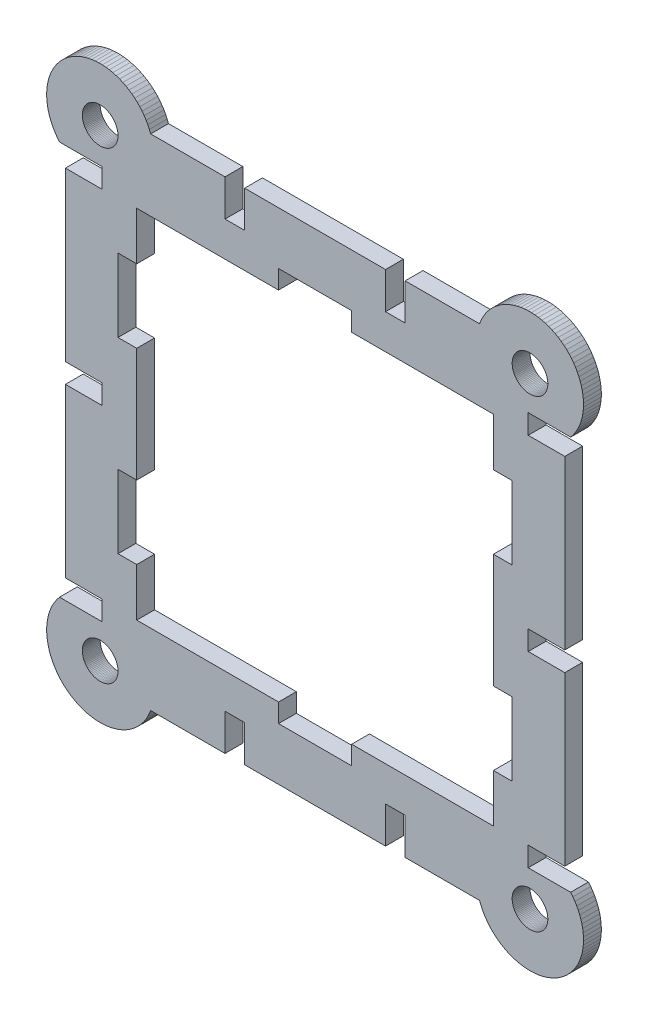
from build123d import *

# Parameters (mm, degrees)
BOSS_EXTRUDE1_DEPTH = 2.5


with BuildPart() as part:
    # Sketch1 → Boss-Extrude1 (new, symmetric)
    with BuildSketch(Plane.XY):
        Polygon((1128.295659386, -84.191167375), (1128.295659386, -73.941167375), (1107.438315784, -73.941167375), (1107.076497539, -73.016401308), (1106.654284467, -72.117601639), (1106.173526996, -71.248707529), (1105.636332136, -70.413527067), (1105.045054244, -69.615720588), (1104.402284707, -68.858784631), (1103.710840583, -68.146036607), (1102.973752255, -67.48060027), (1102.194250151, -66.865392019), (1101.375750586, -66.30310812), (1100.521840788, -65.796212886), (1099.636263175, -65.346927883), (1098.72289896, -64.957222185), (1097.78575113, -64.628803751), (1096.828926914, -64.363111936), (1095.856619772, -64.161311185), (1094.873091023, -64.024285927), (1093.882651166, -63.952636701), (1092.88964099, -63.946677523), (1091.898412548, -64.006434511), (1090.913310085, -64.131645769), (1089.938650997, -64.321762533), (1088.978706911, -64.575951583), (1088.037684961, -64.893098887), (1087.119709354, -65.271814487), (1086.228803288, -65.710438591), (1085.368871329, -66.207048847), (1084.543682287, -66.759468767), (1083.75685271, -67.365277266), (1083.011831026, -68.021819277), (1082.311882432, -68.726217379), (1081.660074583, -69.475384417), (1081.059264151, -70.266037025), (1080.5120843, -71.09471002), (1080.020933147, -71.957771586), (1079.587963256, -72.851439195), (1079.215072198, -73.77179618), (1078.903894238, -74.714808905), (1078.655793171, -75.676344438), (1078.471856348, -76.652188671), (1078.352889906, -77.638064783), (1078.299415237, -78.629651986), (1078.311666705, -79.622604464), (1078.389590615, -80.612570416), (1078.532845451, -81.59521113), (1078.740803371, -82.56622), (1079.012552962, -83.521341396), (1079.34690323, -84.45638932), (1079.742388821, -85.367265749), (1080.197276446, -86.249978596), (1080.709572474, -87.100659207), (1081.277031673, -87.915579313), (1081.897167045, -88.691167375), (1093.795659386, -88.691167375), (1093.795659386, -94.191167375), (1083.545659386, -94.191167375), (1083.545659386, -141.191167375), (1093.795659386, -141.191167375), (1093.795659386, -146.691167375), (1083.545659386, -146.691167375), (1083.545659386, -193.691167375), (1093.795659386, -193.691167375), (1093.795659386, -199.191167375), (1081.897167045, -199.191167375), (1081.277031673, -199.966755437), (1080.709572474, -200.781675543), (1080.197276446, -201.632356153), (1079.742388821, -202.515069), (1079.34690323, -203.425945429), (1079.012552962, -204.360993353), (1078.740803371, -205.31611475), (1078.532845451, -206.287123619), (1078.389590615, -207.269764334), (1078.311666705, -208.259730286), (1078.299415237, -209.252682764), (1078.352889906, -210.244269967), (1078.471856348, -211.230146078), (1078.655793171, -212.205990311), (1078.903894238, -213.167525845), (1079.215072198, -214.110538569), (1079.587963256, -215.030895555), (1080.020933147, -215.924563164), (1080.5120843, -216.78762473), (1081.059264151, -217.616297724), (1081.660074583, -218.406950332), (1082.311882432, -219.15611737), (1083.011831026, -219.860515473), (1083.75685271, -220.517057483), (1084.543682287, -221.122865983), (1085.368871329, -221.675285903), (1086.228803288, -222.171896159), (1087.119709354, -222.610520263), (1088.037684961, -222.989235863), (1088.978706911, -223.306383166), (1089.938650997, -223.560572216), (1090.913310085, -223.750688981), (1091.898412548, -223.875900238), (1092.88964099, -223.935657226), (1093.882651166, -223.929698049), (1094.873091023, -223.858048823), (1095.856619772, -223.721023565), (1096.828926914, -223.519222813), (1097.78575113, -223.253530999), (1098.72289896, -222.925112565), (1099.636263175, -222.535406867), (1100.521840788, -222.086121863), (1101.375750586, -221.57922663), (1102.194250151, -221.01694273), (1102.973752255, -220.401734479), (1103.710840583, -219.736298142), (1104.402284707, -219.023550119), (1105.045054244, -218.266614161), (1105.636332136, -217.468807683), (1106.173526996, -216.633627221), (1106.654284467, -215.76473311), (1107.076497539, -214.865933442), (1107.438315784, -213.941167375), (1128.295659386, -213.941167375), (1128.295659386, -203.691167375), (1133.795659386, -203.691167375), (1133.795659386, -213.941167375), (1173.295659386, -213.941167375), (1173.295659386, -203.691167375), (1178.795659386, -203.691167375), (1178.795659386, -213.941167375), (1199.653002988, -213.941167375), (1200.014821233, -214.865933442), (1200.437034305, -215.76473311), (1200.917791776, -216.633627221), (1201.454986636, -217.468807683), (1202.046264528, -218.266614161), (1202.689034065, -219.023550119), (1203.380478189, -219.736298142), (1204.117566517, -220.401734479), (1204.89706862, -221.01694273), (1205.715568186, -221.57922663), (1206.569477984, -222.086121863), (1207.455055596, -222.535406867), (1208.368419812, -222.925112565), (1209.305567641, -223.253530999), (1210.262391858, -223.519222813), (1211.234699, -223.721023565), (1212.218227749, -223.858048823), (1213.208667606, -223.929698049), (1214.201677782, -223.935657226), (1215.192906224, -223.875900238), (1216.178008687, -223.750688981), (1217.152667775, -223.560572216), (1218.112611861, -223.306383166), (1219.053633811, -222.989235863), (1219.971609418, -222.610520263), (1220.862515483, -222.171896159), (1221.722447443, -221.675285903), (1222.547636485, -221.122865983), (1223.334466061, -220.517057483), (1224.079487746, -219.860515473), (1224.77943634, -219.15611737), (1225.431244189, -218.406950332), (1226.032054621, -217.616297724), (1226.579234472, -216.78762473), (1227.070385625, -215.924563164), (1227.503355516, -215.030895555), (1227.876246574, -214.110538569), (1228.187424534, -213.167525845), (1228.435525601, -212.205990311), (1228.619462424, -211.230146078), (1228.738428866, -210.244269967), (1228.791903535, -209.252682764), (1228.779652067, -208.259730286), (1228.701728157, -207.269764334), (1228.558473321, -206.287123619), (1228.3505154, -205.31611475), (1228.07876581, -204.360993353), (1227.744415542, -203.425945429), (1227.348929951, -202.515069), (1226.894042326, -201.632356153), (1226.381746298, -200.781675543), (1225.814287099, -199.966755437), (1225.194151727, -199.191167375), (1213.295659386, -199.191167375), (1213.295659386, -193.691167375), (1223.545659386, -193.691167375), (1223.545659386, -146.691167375), (1213.295659386, -146.691167375), (1213.295659386, -141.191167375), (1223.545659386, -141.191167375), (1223.545659386, -94.191167375), (1213.295659386, -94.191167375), (1213.295659386, -88.691167375), (1225.194151727, -88.691167375), (1225.814287099, -87.915579313), (1226.381746298, -87.100659207), (1226.894042326, -86.249978596), (1227.348929951, -85.367265749), (1227.744415542, -84.45638932), (1228.07876581, -83.521341396), (1228.3505154, -82.56622), (1228.558473321, -81.59521113), (1228.701728157, -80.612570416), (1228.779652067, -79.622604464), (1228.791903535, -78.629651986), (1228.738428866, -77.638064783), (1228.619462424, -76.652188671), (1228.435525601, -75.676344438), (1228.187424534, -74.714808905), (1227.876246574, -73.77179618), (1227.503355516, -72.851439195), (1227.070385625, -71.957771586), (1226.579234472, -71.09471002), (1226.032054621, -70.266037025), (1225.431244189, -69.475384417), (1224.77943634, -68.726217379), (1224.079487746, -68.021819277), (1223.334466061, -67.365277266), (1222.547636485, -66.759468766), (1221.722447443, -66.207048847), (1220.862515483, -65.710438591), (1219.971609418, -65.271814487), (1219.053633811, -64.893098887), (1218.112611861, -64.575951583), (1217.152667775, -64.321762533), (1216.178008687, -64.131645769), (1215.192906224, -64.006434511), (1214.201677782, -63.946677523), (1213.208667606, -63.952636701), (1212.218227749, -64.024285927), (1211.234699, -64.161311185), (1210.262391858, -64.363111936), (1209.305567641, -64.628803751), (1208.368419812, -64.957222185), (1207.455055596, -65.346927883), (1206.569477984, -65.796212886), (1205.715568186, -66.30310812), (1204.89706862, -66.865392019), (1204.117566517, -67.48060027), (1203.380478189, -68.146036607), (1202.689034065, -68.858784631), (1202.046264528, -69.615720588), (1201.454986636, -70.413527067), (1200.917791776, -71.248707529), (1200.437034305, -72.117601639), (1200.014821233, -73.016401308), (1199.653002988, -73.941167375), (1178.795659386, -73.941167375), (1178.795659386, -84.191167375), (1173.295659386, -84.191167375), (1173.295659386, -73.941167375), (1133.795659386, -73.941167375), (1133.795659386, -84.191167375), align=None)
        Polygon((1143.295659386, -88.691167375), (1143.295659386, -93.941167375), (1103.545659386, -93.941167375), (1103.545659386, -107.441167375), (1098.295659386, -107.441167375), (1098.295659386, -127.941167375), (1103.545659386, -127.941167375), (1103.545659386, -159.94119829), (1098.295659386, -159.941167375), (1098.295659386, -180.441167375), (1103.545659386, -180.441167375), (1103.545659386, -193.941167375), (1143.295659386, -193.941167375), (1143.295659386, -199.191167375), (1163.795659386, -199.191167375), (1163.795659386, -193.941167375), (1203.545659386, -193.941167375), (1203.545659386, -180.441167375), (1208.795659386, -180.441167375), (1208.795659386, -159.941167375), (1203.545659386, -159.94119829), (1203.545659386, -127.941167375), (1208.795659386, -127.941167375), (1208.795659386, -107.441167375), (1203.545659386, -107.441167375), (1203.545659386, -93.941167375), (1163.795659386, -93.941167375), (1163.795659386, -88.691167375), align=None, mode=Mode.SUBTRACT)
        Polygon((1095.507623611, -204.456803667), (1095.79618016, -204.611040356), (1096.074031325, -204.783819313), (1096.339987305, -204.974400673), (1096.592909236, -205.181968337), (1096.831714066, -205.405633469), (1097.055379198, -205.644438299), (1097.262946862, -205.89736023), (1097.453528222, -206.16331621), (1097.626307179, -206.441167375), (1097.780543868, -206.729723924), (1097.915577823, -207.027750213), (1098.030830808, -207.333970048), (1098.125809292, -207.647072149), (1098.200106562, -207.965715765), (1098.253404467, -208.288536414), (1098.285474776, -208.614151729), (1098.29618016, -208.941167375), (1098.285474776, -209.268183021), (1098.253404467, -209.593798336), (1098.200106562, -209.916618985), (1098.125809292, -210.2352626), (1098.030830808, -210.548364701), (1097.915577823, -210.854584537), (1097.780543868, -211.152610826), (1097.626307179, -211.441167375), (1097.453528222, -211.71901854), (1097.262946862, -211.98497452), (1097.055379198, -212.23789645), (1096.831714066, -212.476701281), (1096.592909236, -212.700366412), (1096.339987305, -212.907934076), (1096.074031325, -213.098515436), (1095.79618016, -213.271294394), (1095.507623611, -213.425531082), (1095.209597322, -213.560565037), (1094.903377487, -213.675818022), (1094.590275386, -213.770796506), (1094.27163177, -213.845093777), (1093.948811121, -213.898391682), (1093.623195806, -213.930461991), (1093.29618016, -213.941167375), (1092.969164514, -213.930461991), (1092.643549199, -213.898391682), (1092.32072855, -213.845093777), (1092.002084935, -213.770796506), (1091.688982834, -213.675818022), (1091.382762998, -213.560565037), (1091.084736709, -213.425531082), (1090.79618016, -213.271294394), (1090.518328995, -213.098515436), (1090.252373015, -212.907934076), (1089.999451085, -212.700366412), (1089.760646254, -212.476701281), (1089.536981123, -212.23789645), (1089.329413459, -211.98497452), (1089.138832099, -211.71901854), (1088.966053141, -211.441167375), (1088.811816453, -211.152610826), (1088.676782498, -210.854584537), (1088.561529513, -210.548364701), (1088.466551029, -210.2352626), (1088.392253758, -209.916618985), (1088.338955853, -209.593798336), (1088.306885544, -209.268183021), (1088.29618016, -208.941167375), (1088.306885544, -208.614151729), (1088.338955853, -208.288536414), (1088.392253758, -207.965715765), (1088.466551029, -207.647072149), (1088.561529513, -207.333970048), (1088.676782498, -207.027750213), (1088.811816453, -206.729723924), (1088.966053141, -206.441167375), (1089.138832099, -206.16331621), (1089.329413459, -205.89736023), (1089.536981123, -205.644438299), (1089.760646254, -205.405633469), (1089.999451085, -205.181968337), (1090.252373015, -204.974400673), (1090.518328995, -204.783819313), (1090.79618016, -204.611040356), (1091.084736709, -204.456803667), (1091.382762998, -204.321769712), (1091.688982834, -204.206516727), (1092.002084935, -204.111538243), (1092.32072855, -204.037240973), (1092.643549199, -203.983943068), (1092.969164514, -203.951872759), (1093.29618016, -203.941167375), (1093.623195806, -203.951872759), (1093.948811121, -203.983943068), (1094.27163177, -204.037240973), (1094.590275386, -204.111538243), (1094.903377487, -204.206516727), (1095.209597322, -204.321769712), align=None, mode=Mode.SUBTRACT)
        Polygon((1094.590275386, -74.111538243), (1094.903377487, -74.206516727), (1095.209597322, -74.321769712), (1095.507623611, -74.456803667), (1095.79618016, -74.611040356), (1096.074031325, -74.783819313), (1096.339987305, -74.974400673), (1096.592909236, -75.181968337), (1096.831714066, -75.405633469), (1097.055379198, -75.644438299), (1097.262946862, -75.89736023), (1097.453528222, -76.16331621), (1097.626307179, -76.441167375), (1097.780543868, -76.729723924), (1097.915577823, -77.027750213), (1098.030830808, -77.333970048), (1098.125809292, -77.647072149), (1098.200106562, -77.965715765), (1098.253404467, -78.288536414), (1098.285474776, -78.614151729), (1098.29618016, -78.941167375), (1098.285474776, -79.268183021), (1098.253404467, -79.593798336), (1098.200106562, -79.916618985), (1098.125809292, -80.2352626), (1098.030830808, -80.548364701), (1097.915577823, -80.854584537), (1097.780543868, -81.152610826), (1097.626307179, -81.441167375), (1097.453528222, -81.71901854), (1097.262946862, -81.98497452), (1097.055379198, -82.23789645), (1096.831714066, -82.476701281), (1096.592909236, -82.700366412), (1096.339987305, -82.907934076), (1096.074031325, -83.098515436), (1095.79618016, -83.271294394), (1095.507623611, -83.425531082), (1095.209597322, -83.560565037), (1094.903377487, -83.675818022), (1094.590275386, -83.770796506), (1094.27163177, -83.845093777), (1093.948811121, -83.898391682), (1093.623195806, -83.930461991), (1093.29618016, -83.941167375), (1092.969164514, -83.930461991), (1092.643549199, -83.898391682), (1092.32072855, -83.845093777), (1092.002084935, -83.770796506), (1091.688982834, -83.675818022), (1091.382762998, -83.560565037), (1091.084736709, -83.425531082), (1090.79618016, -83.271294394), (1090.518328995, -83.098515436), (1090.252373015, -82.907934076), (1089.999451085, -82.700366412), (1089.760646254, -82.476701281), (1089.536981123, -82.23789645), (1089.329413459, -81.98497452), (1089.138832099, -81.71901854), (1088.966053141, -81.441167375), (1088.811816453, -81.152610826), (1088.676782498, -80.854584537), (1088.561529513, -80.548364701), (1088.466551029, -80.2352626), (1088.392253758, -79.916618985), (1088.338955853, -79.593798336), (1088.306885544, -79.268183021), (1088.29618016, -78.941167375), (1088.306885544, -78.614151729), (1088.338955853, -78.288536414), (1088.392253758, -77.965715765), (1088.466551029, -77.647072149), (1088.561529513, -77.333970048), (1088.676782498, -77.027750213), (1088.811816453, -76.729723924), (1088.966053141, -76.441167375), (1089.138832099, -76.16331621), (1089.329413459, -75.89736023), (1089.536981123, -75.644438299), (1089.760646254, -75.405633469), (1089.999451085, -75.181968337), (1090.252373015, -74.974400673), (1090.518328995, -74.783819313), (1090.79618016, -74.611040356), (1091.084736709, -74.456803667), (1091.382762998, -74.321769712), (1091.688982834, -74.206516727), (1092.002084935, -74.111538243), (1092.32072855, -74.037240973), (1092.643549199, -73.983943068), (1092.969164514, -73.951872759), (1093.29618016, -73.941167375), (1093.623195806, -73.951872759), (1093.948811121, -73.983943068), (1094.27163177, -74.037240973), align=None, mode=Mode.SUBTRACT)
        Polygon((1217.952486673, -76.16331621), (1218.12526563, -76.441167375), (1218.279502319, -76.729723924), (1218.414536274, -77.027750213), (1218.529789259, -77.333970048), (1218.624767743, -77.647072149), (1218.699065013, -77.965715765), (1218.752362918, -78.288536414), (1218.784433228, -78.614151729), (1218.795138611, -78.941167375), (1218.784433228, -79.268183021), (1218.752362918, -79.593798336), (1218.699065013, -79.916618985), (1218.624767743, -80.2352626), (1218.529789259, -80.548364701), (1218.414536274, -80.854584537), (1218.279502319, -81.152610826), (1218.12526563, -81.441167375), (1217.952486673, -81.71901854), (1217.761905313, -81.98497452), (1217.554337649, -82.23789645), (1217.330672517, -82.476701281), (1217.091867687, -82.700366412), (1216.838945757, -82.907934076), (1216.572989777, -83.098515436), (1216.295138611, -83.271294394), (1216.006582063, -83.425531082), (1215.708555773, -83.560565037), (1215.402335938, -83.675818022), (1215.089233837, -83.770796506), (1214.770590222, -83.845093777), (1214.447769573, -83.898391682), (1214.122154258, -83.930461991), (1213.795138611, -83.941167375), (1213.468122965, -83.930461991), (1213.14250765, -83.898391682), (1212.819687001, -83.845093777), (1212.501043386, -83.770796506), (1212.187941285, -83.675818022), (1211.88172145, -83.560565037), (1211.58369516, -83.425531082), (1211.295138611, -83.271294394), (1211.017287446, -83.098515436), (1210.751331466, -82.907934076), (1210.498409536, -82.700366412), (1210.259604706, -82.476701281), (1210.035939574, -82.23789645), (1209.82837191, -81.98497452), (1209.63779055, -81.71901854), (1209.465011593, -81.441167375), (1209.310774904, -81.152610826), (1209.175740949, -80.854584537), (1209.060487964, -80.548364701), (1208.96550948, -80.2352626), (1208.891212209, -79.916618985), (1208.837914305, -79.593798336), (1208.805843995, -79.268183021), (1208.795138611, -78.941167375), (1208.805843995, -78.614151729), (1208.837914305, -78.288536414), (1208.891212209, -77.965715765), (1208.96550948, -77.647072149), (1209.060487964, -77.333970048), (1209.175740949, -77.027750213), (1209.310774904, -76.729723924), (1209.465011593, -76.441167375), (1209.63779055, -76.16331621), (1209.82837191, -75.89736023), (1210.035939574, -75.644438299), (1210.259604706, -75.405633469), (1210.498409536, -75.181968337), (1210.751331466, -74.974400673), (1211.017287446, -74.783819313), (1211.295138611, -74.611040356), (1211.58369516, -74.456803667), (1211.88172145, -74.321769712), (1212.187941285, -74.206516727), (1212.501043386, -74.111538243), (1212.819687001, -74.037240973), (1213.14250765, -73.983943068), (1213.468122965, -73.951872759), (1213.795138611, -73.941167375), (1214.122154258, -73.951872759), (1214.447769573, -73.983943068), (1214.770590222, -74.037240973), (1215.089233837, -74.111538243), (1215.402335938, -74.206516727), (1215.708555773, -74.321769712), (1216.006582063, -74.456803667), (1216.295138611, -74.611040356), (1216.572989777, -74.783819313), (1216.838945757, -74.974400673), (1217.091867687, -75.181968337), (1217.330672517, -75.405633469), (1217.554337649, -75.644438299), (1217.761905313, -75.89736023), align=None, mode=Mode.SUBTRACT)
        Polygon((1217.554337649, -205.644438299), (1217.761905313, -205.89736023), (1217.952486673, -206.16331621), (1218.12526563, -206.441167375), (1218.279502319, -206.729723924), (1218.414536274, -207.027750213), (1218.529789259, -207.333970048), (1218.624767743, -207.647072149), (1218.699065013, -207.965715765), (1218.752362918, -208.288536414), (1218.784433228, -208.614151729), (1218.795138611, -208.941167375), (1218.784433228, -209.268183021), (1218.752362918, -209.593798336), (1218.699065013, -209.916618985), (1218.624767743, -210.2352626), (1218.529789259, -210.548364701), (1218.414536274, -210.854584537), (1218.279502319, -211.152610826), (1218.12526563, -211.441167375), (1217.952486673, -211.71901854), (1217.761905313, -211.98497452), (1217.554337649, -212.23789645), (1217.330672517, -212.476701281), (1217.091867687, -212.700366412), (1216.838945757, -212.907934076), (1216.572989777, -213.098515436), (1216.295138611, -213.271294394), (1216.006582063, -213.425531082), (1215.708555773, -213.560565037), (1215.402335938, -213.675818022), (1215.089233837, -213.770796506), (1214.770590222, -213.845093777), (1214.447769573, -213.898391682), (1214.122154258, -213.930461991), (1213.795138611, -213.941167375), (1213.468122965, -213.930461991), (1213.14250765, -213.898391682), (1212.819687001, -213.845093777), (1212.501043386, -213.770796506), (1212.187941285, -213.675818022), (1211.88172145, -213.560565037), (1211.58369516, -213.425531082), (1211.295138611, -213.271294394), (1211.017287446, -213.098515436), (1210.751331466, -212.907934076), (1210.498409536, -212.700366412), (1210.259604706, -212.476701281), (1210.035939574, -212.23789645), (1209.82837191, -211.98497452), (1209.63779055, -211.71901854), (1209.465011593, -211.441167375), (1209.310774904, -211.152610826), (1209.175740949, -210.854584537), (1209.060487964, -210.548364701), (1208.96550948, -210.2352626), (1208.891212209, -209.916618985), (1208.837914305, -209.593798336), (1208.805843995, -209.268183021), (1208.795138611, -208.941167375), (1208.805843995, -208.614151729), (1208.837914305, -208.288536414), (1208.891212209, -207.965715765), (1208.96550948, -207.647072149), (1209.060487964, -207.333970048), (1209.175740949, -207.027750213), (1209.310774904, -206.729723924), (1209.465011593, -206.441167375), (1209.63779055, -206.16331621), (1209.82837191, -205.89736023), (1210.035939574, -205.644438299), (1210.259604706, -205.405633469), (1210.498409536, -205.181968337), (1210.751331466, -204.974400673), (1211.017287446, -204.783819313), (1211.295138611, -204.611040356), (1211.58369516, -204.456803667), (1211.88172145, -204.321769712), (1212.187941285, -204.206516727), (1212.501043386, -204.111538243), (1212.819687001, -204.037240973), (1213.14250765, -203.983943068), (1213.468122965, -203.951872759), (1213.795138611, -203.941167375), (1214.122154258, -203.951872759), (1214.447769573, -203.983943068), (1214.770590222, -204.037240973), (1215.089233837, -204.111538243), (1215.402335938, -204.206516727), (1215.708555773, -204.321769712), (1216.006582063, -204.456803667), (1216.295138611, -204.611040356), (1216.572989777, -204.783819313), (1216.838945757, -204.974400673), (1217.091867687, -205.181968337), (1217.330672517, -205.405633469), align=None, mode=Mode.SUBTRACT)
    extrude(amount=BOSS_EXTRUDE1_DEPTH, both=True)


solid = part.part
